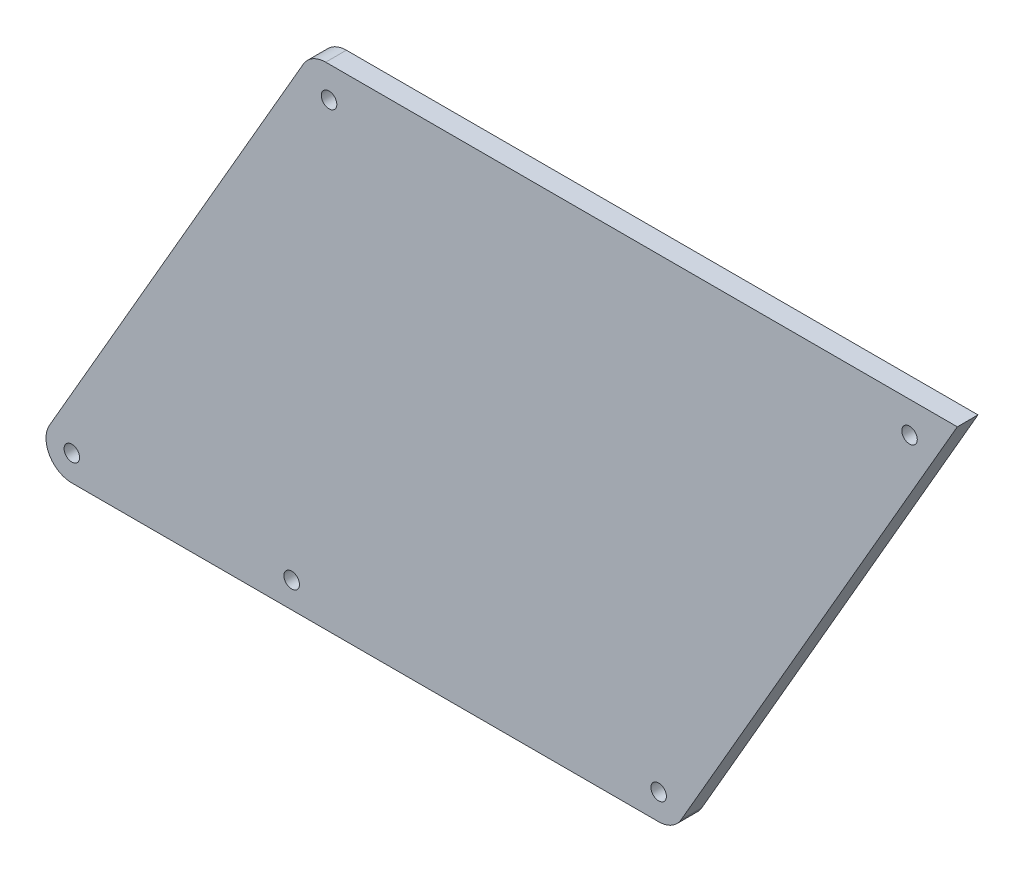
from build123d import *

# Parameters (mm, degrees)
BOSS_EXTRU_1_DEPTH      = 8
ESQUISSE2_R             = 3
ENL_V_MAT_EXTRU_1_DEPTH = 1597.033446326


with BuildPart() as part:
    # Esquisse1 → Boss.-Extru.1 (new body)
    with BuildSketch(Plane.XY):
        with BuildLine():
            Line((5.773502692, 0), (250, 0))
            Line((250, 0), (143.1902002, -185))
            ThreePointArc((143.1902002, -185), (139.529946162, -188.660254038), (134.529946162, -190))
            Line((134.529946162, -190), (-92.37604307, -190))
            ThreePointArc((-92.37604307, -190), (-101.036297108, -185), (-101.036297108, -175))
            Line((-101.036297108, -175), (-2.886751346, -5))
            ThreePointArc((-2.886751346, -5), (0.773502692, -1.339745962), (5.773502692, 0))
        make_face()
    extrude(amount=BOSS_EXTRU_1_DEPTH)

    # Esquisse2 → Enlèv. mat.-Extru.1 (cut, through all)
    with BuildSketch(Plane(origin=(-1216.410161514, -630, 8), x_dir=(1, 0, 0), z_dir=(0, 0, 1))):
        with Locations((1124.034118443, 450)):
            Circle(ESQUISSE2_R)
        with Locations((1209.034118443, 450)):
            Circle(ESQUISSE2_R)
        with Locations((1223.481958283, 618)):
            Circle(ESQUISSE2_R)
        with Locations((1447.9349529, 618)):
            Circle(ESQUISSE2_R)
        with Locations((1350.940107676, 450)):
            Circle(ESQUISSE2_R)
    extrude(amount=-ENL_V_MAT_EXTRU_1_DEPTH, mode=Mode.SUBTRACT)


solid = part.part
